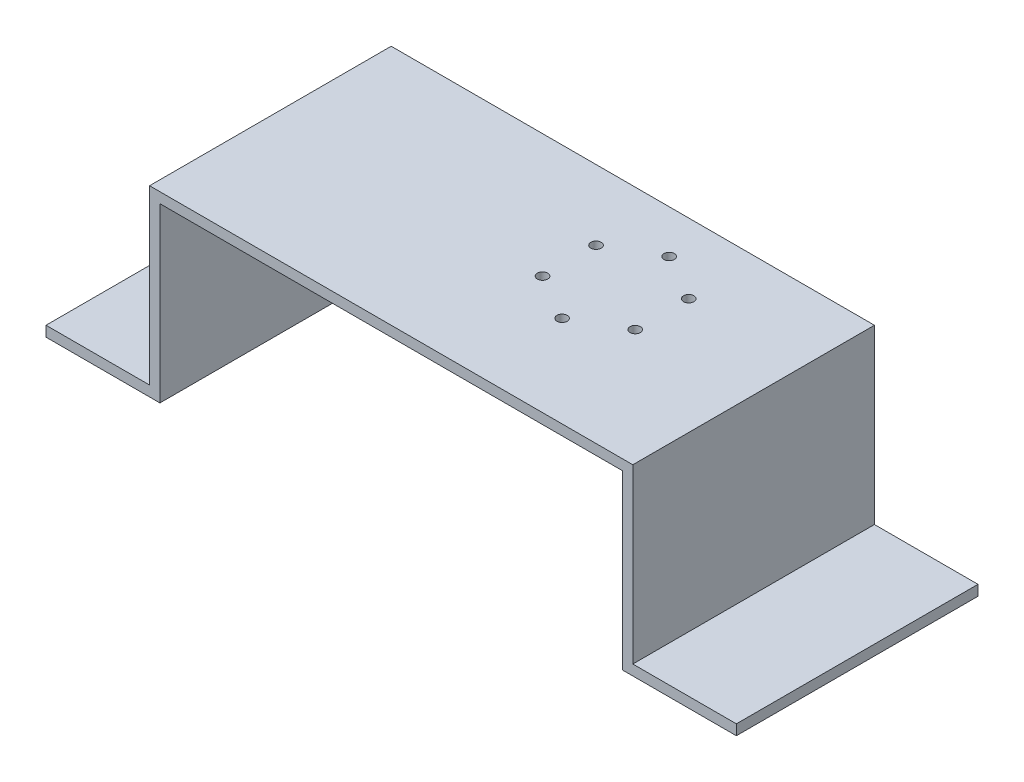
from build123d import *

# Parameters (mm, degrees)
EXTRUDE_1_DEPTH     = 70
SKETCH_2_R          = 1.5
CUT_EXTRUDE_1_DEPTH = 10


with BuildPart() as part:
    # 草图1 → 凸台-拉伸1 (new body)
    with BuildSketch(Plane.XY):
        Polygon((0, 0), (30, 0), (30, 50), (170, 50), (170, 0), (200, 0), (200, -3), (167, -3), (167, 47), (33, 47), (33, -3), (0, -3), align=None)
    extrude(amount=EXTRUDE_1_DEPTH)

    # 草图2 → 切除-拉伸1 (cut)
    with BuildSketch(Plane(origin=(0, 50, 0), x_dir=(1, 0, 0), z_dir=(0, 1, 0))):
        with Locations(Location((123.018011593, -43.499999999, 0), (0, 0, 270))):
            Circle(SKETCH_2_R)
        with Locations(Location((136.441405352, -35.749999999, 0), (0, 0, 270))):
            Circle(SKETCH_2_R)
        with Locations(Location((136.441405352, -20.249999999, 0), (0, 0, 270))):
            Circle(SKETCH_2_R)
        with Locations(Location((123.018011593, -12.499999999, 0), (0, 0, 270))):
            Circle(SKETCH_2_R)
        with Locations(Location((109.594617835, -35.749999999, 0), (0, 0, 270))):
            Circle(SKETCH_2_R)
        with Locations(Location((109.594617835, -20.249999999, 0), (0, 0, 270))):
            Circle(SKETCH_2_R)
    extrude(amount=-CUT_EXTRUDE_1_DEPTH, mode=Mode.SUBTRACT)


solid = part.part
